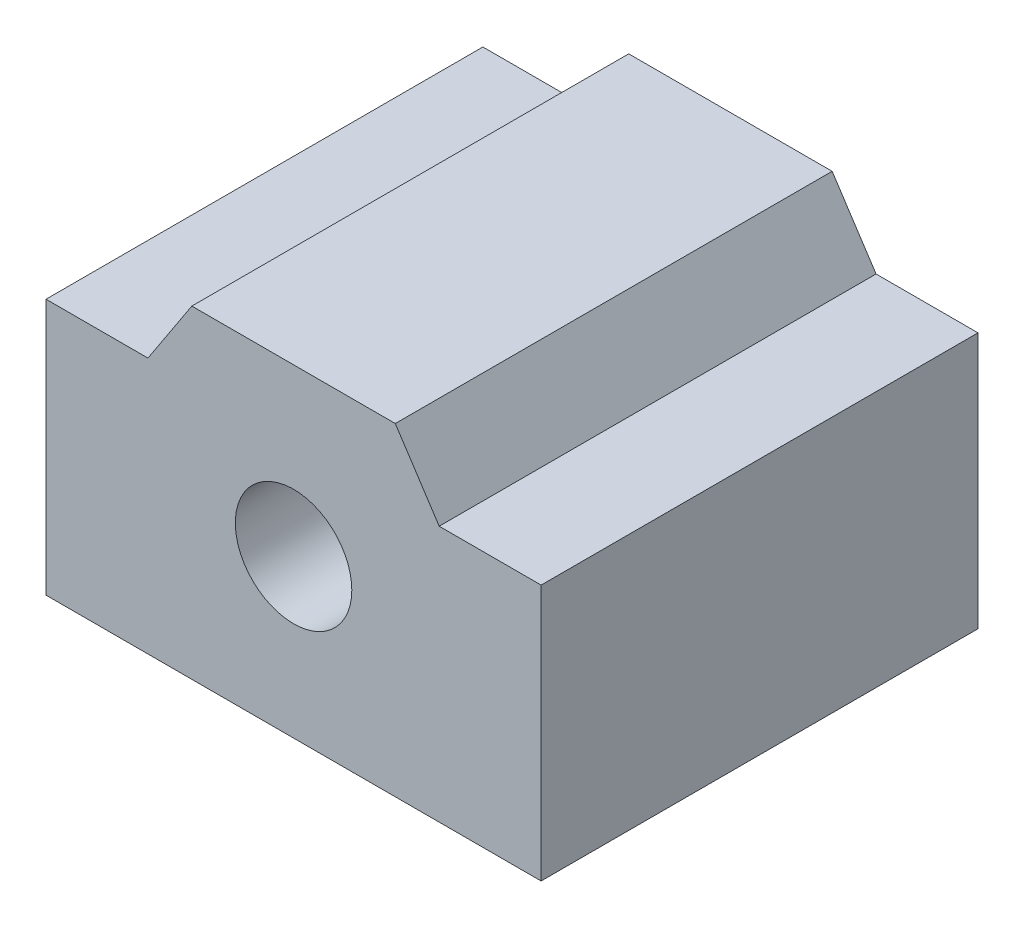
from build123d import *

# Parameters (mm, degrees)
SKETCH1_W           = 34
SKETCH1_H           = 30
BOSS_EXTRUDE1_DEPTH = 22.2
CUT_EXTRUDE1_DEPTH  = 51.486037674
SKETCH3_R           = 4
CUT_EXTRUDE2_DEPTH  = 51.486037674


with BuildPart() as part:
    # Sketch1 → Boss-Extrude1 (new body)
    with BuildSketch(Plane(origin=(0, 0, 0), x_dir=(1, 0, 0), z_dir=(0, 1, 0))):
        with Locations((17, 15)):
            Rectangle(SKETCH1_W, SKETCH1_H)
    extrude(amount=BOSS_EXTRUDE1_DEPTH)

    # Sketch2 → Cut-Extrude1 (cut, through all)
    with BuildSketch(Plane.XY):
        Polygon((34, 17.6), (27, 17.6), (23.985037314, 22.2), (34, 22.2), align=None)
        Polygon((0, 22.2), (0, 17.6), (7, 17.6), (10.014962686, 22.2), align=None)
    extrude(amount=-CUT_EXTRUDE1_DEPTH, mode=Mode.SUBTRACT)

    # Sketch3 → Cut-Extrude2 (cut, through all)
    with BuildSketch(Plane.XY):
        with Locations((17, 10.8)):
            Circle(SKETCH3_R)
    extrude(amount=-CUT_EXTRUDE2_DEPTH, mode=Mode.SUBTRACT)


solid = part.part
